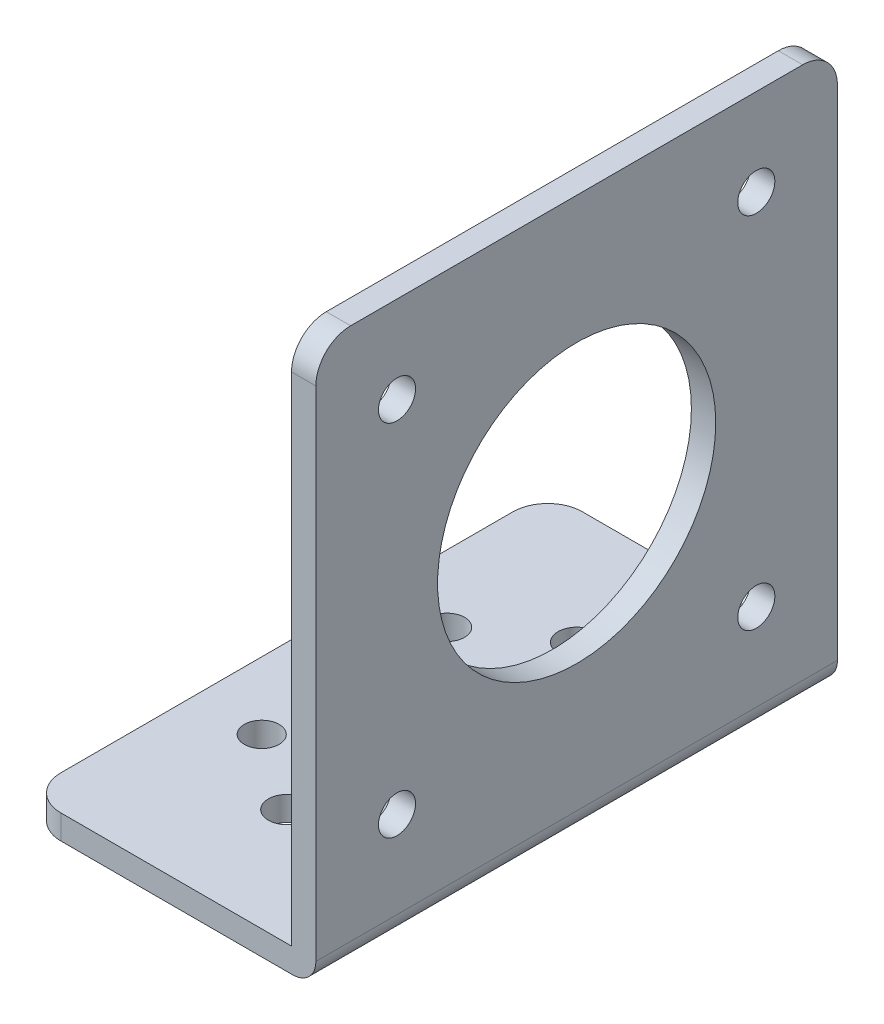
from build123d import *

# Parameters (mm, degrees)
SKETCH1_W                      = 45
SKETCH1_H                      = 48
BOSS_EXTRUDE1_DEPTH            = 25
SKETCH2_W                      = 22.9
SKETCH2_H                      = 45.9
CUT_EXTRUDE1_DEPTH             = 70.666419457
F_24_0_24_DIAMETER_HOLE1_D     = 24
F_24_0_24_DIAMETER_HOLE1_DEPTH = 25
F_3_2_3_2_DIAMETER_HOLE1_D     = 3.2
F_3_2_3_2_DIAMETER_HOLE1_DEPTH = 25
F_3_2_3_2_DIAMETER_HOLE2_D     = 3.2
FILLET1_R                      = 2
FILLET2_R                      = 3
F_3_0_3_DIAMETER_HOLE1_D       = 3


with BuildPart() as part:
    # Sketch1 → Boss-Extrude1 (new body)
    with BuildSketch(Plane(origin=(2.1, 0, 0), x_dir=(0, 0, -1), z_dir=(1, 0, 0))):
        with Locations((0, 24)):
            Rectangle(SKETCH1_W, SKETCH1_H)
    extrude(amount=-BOSS_EXTRUDE1_DEPTH)

    # Sketch2 → Cut-Extrude1 (cut, through all)
    with BuildSketch(Plane(origin=(0, 0, -22.5), x_dir=(-1, 0, 0), z_dir=(0, 0, -1))):
        with Locations((11.45, 25.05)):
            Rectangle(SKETCH2_W, SKETCH2_H)
    extrude(amount=-CUT_EXTRUDE1_DEPTH, mode=Mode.SUBTRACT)

    # Ø24.0 (24) Diameter Hole1
    with Locations(Plane(origin=(2.1, 0, 0), x_dir=(0, 0, -1), z_dir=(1, 0, 0))):
        with Locations((0, 25)):
            Hole(F_24_0_24_DIAMETER_HOLE1_D / 2, depth=F_24_0_24_DIAMETER_HOLE1_DEPTH)

    # Ø3.2 (3.2) Diameter Hole1
    with Locations(Plane(origin=(2.1, 0, 0), x_dir=(0, 0, -1), z_dir=(1, 0, 0))):
        with Locations((15.5, 9.5), (-15.5, 40.5), (15.5, 40.5), (-15.5, 9.5)):
            Hole(F_3_2_3_2_DIAMETER_HOLE1_D / 2, depth=F_3_2_3_2_DIAMETER_HOLE1_DEPTH)

    # Ø3.2 (3.2) Diameter Hole2 (through all)
    with Locations(Plane(origin=(0, 2.1, 0), x_dir=(1, 0, 0), z_dir=(0, 1, 0))):
        with Locations((-10.4, 12.5), (-10.4, -12.5)):
            Hole(F_3_2_3_2_DIAMETER_HOLE2_D / 2)

    # Fillet1
    fillet1_edges = [part.edges().sort_by_distance(p)[0] for p in [
        (2.1, 0, 0),
    ]]
    fillet(fillet1_edges, radius=FILLET1_R)

    # Fillet2
    fillet2_edges = [part.edges().sort_by_distance(p)[0] for p in [
        (-22.9, 1.05, 22.5),
        (1.05, 48, -22.5),
        (1.05, 48, 22.5),
        (-22.9, 1.05, -22.5),
    ]]
    fillet(fillet2_edges, radius=FILLET2_R)

    # Ø3.0 (3) Diameter Hole1 (through all)
    with Locations(Plane(origin=(0, 2.1, 0), x_dir=(1, 0, 0), z_dir=(0, 1, 0))):
        with Locations((-2.10285259, 8.031001386), (-2.10285259, -7.968998614), (-17.10285259, 8.031001386), (-17.10285259, -7.968998614)):
            Hole(F_3_0_3_DIAMETER_HOLE1_D / 2)


solid = part.part
